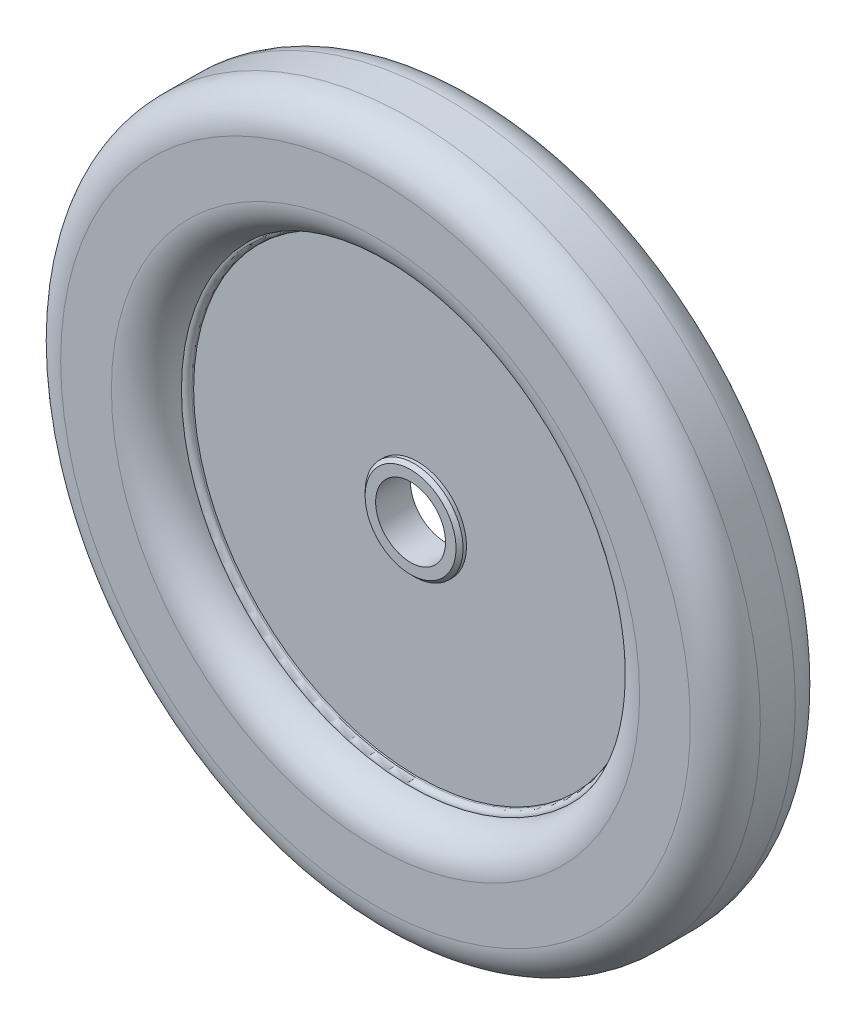
from build123d import *


with BuildPart() as part:
    # Sketch3 → Revolve1 (revolve)
    with BuildSketch(Plane(origin=(0, 0, 0), x_dir=(1, 0, 0), z_dir=(0, 1, 0)), mode=Mode.PRIVATE) as revolve1_sk:
        with BuildLine():
            Line((10, 0), (13, 0))
            Line((13, 0), (14, 1))
            Line((14, 1), (14, 1.979301398))
            Line((14, 1.979301398), (64, 1.979301398))
            Line((64, 1.979301398), (64, 1.5))
            ThreePointArc((64, 1.5), (64.439339828, 0.439339828), (65.5, 0))
            Line((65.5, 0), (65.5, -0.020698602))
            ThreePointArc((65.5, -0.020698602), (68.428932188, -7.091766414), (75.5, -10.020698602))
            Line((75.5, -10.020698602), (90, -10.020698602))
            ThreePointArc((90, -10.020698602), (97.071067812, -7.091766414), (100, -0.020698602))
            Line((100, -0.020698602), (100, 9.979301398))
            ThreePointArc((100, 9.979301398), (97.071067812, 17.05036921), (90, 19.979301398))
            Line((90, 19.979301398), (75.5, 19.979301398))
            ThreePointArc((75.5, 19.979301398), (68.428932188, 17.05036921), (65.5, 9.979301398))
            Line((65.5, 9.979301398), (65.5, 9.958602795))
            ThreePointArc((65.5, 9.958602795), (64.439339828, 9.519262967), (64, 8.458602795))
            Line((64, 8.458602795), (64, 7.979301398))
            Line((64, 7.979301398), (14, 7.979301398))
            Line((14, 7.979301398), (14, 8.958602795))
            Line((14, 8.958602795), (13, 9.958602795))
            Line((13, 9.958602795), (10, 9.958602795))
            Line((10, 9.958602795), (10, 0))
        make_face()
    revolve(revolve1_sk.sketch.rotate(Axis((0, 0, -9.958602795), (0, 0, 1)), 180), axis=Axis((0, 0, -9.958602795), (0, 0, 1)))


solid = part.part
